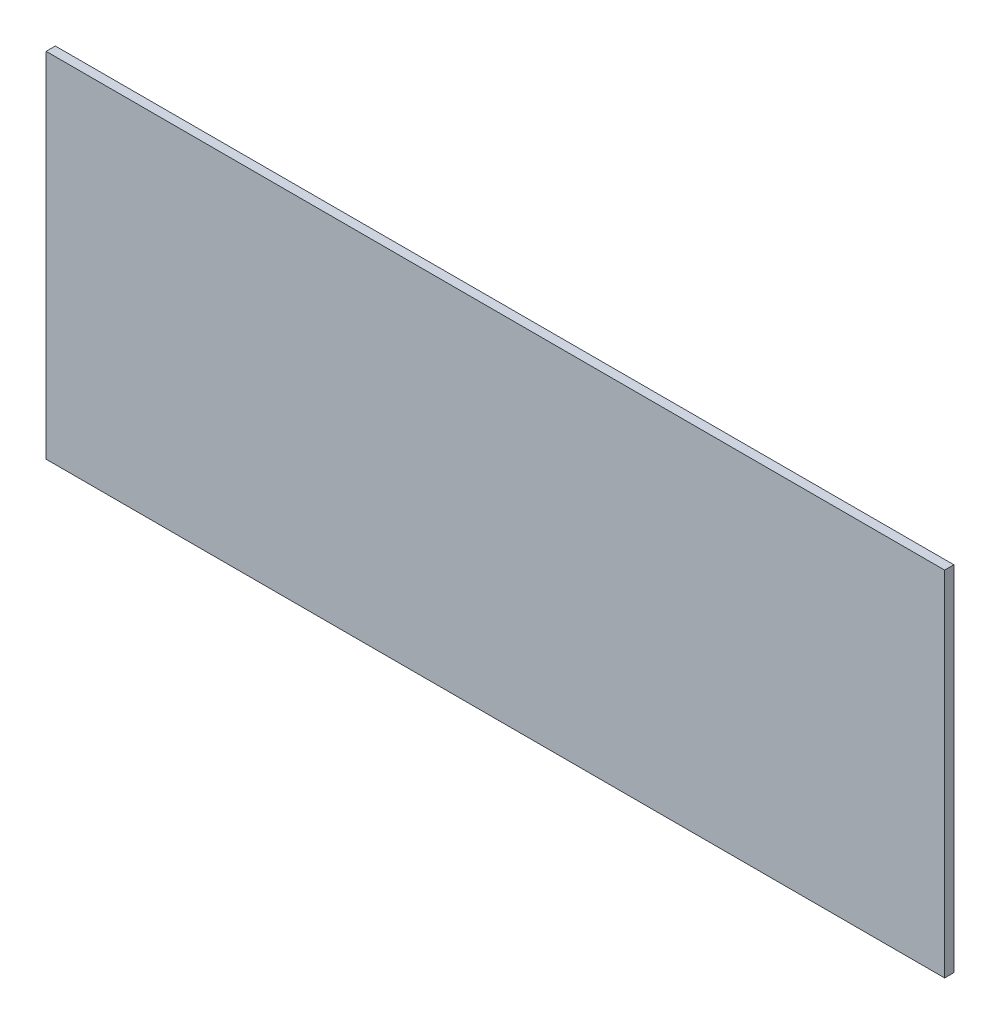
from build123d import *

# Parameters (mm, degrees)
SKETCH1_W           = 292
SKETCH1_H           = 114.8
BOSS_EXTRUDE1_DEPTH = 3


with BuildPart() as part:
    # Sketch1 → Boss-Extrude1 (new body)
    with BuildSketch(Plane(origin=(0, 0, 0), x_dir=(-1, 0, 0), z_dir=(0, 0, -1))):
        Rectangle(SKETCH1_W, SKETCH1_H)
    extrude(amount=-BOSS_EXTRUDE1_DEPTH)


solid = part.part
